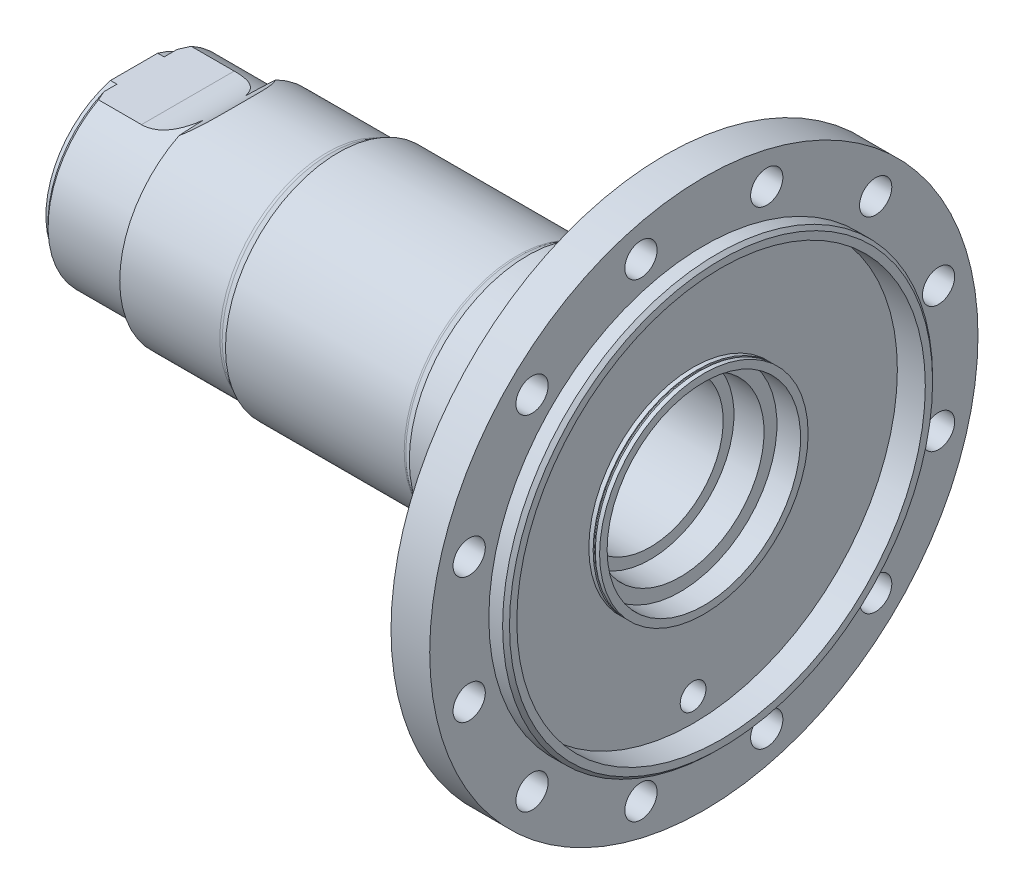
from build123d import *

# Parameters (mm, degrees)
SKETCH_3_W                    = 2
SKETCH_3_H                    = 46.5
SKETCH_5_W                    = 2
SKETCH_5_H                    = 46.5
SKETCH_6_R                    = 7.5
CUT_EXTRUDE_1_DEPTH           = 328.171973127
SKETCH_7_R                    = 7.5
CUT_EXTRUDE_2_DEPTH           = 328.171973127
SKETCH_8_R                    = 7.5
CUT_EXTRUDE_3_DEPTH           = 328.171973127
SKETCH_9_R                    = 7.5
CUT_EXTRUDE_4_DEPTH           = 328.171973127
SKETCH_10_R                   = 7.5
CUT_EXTRUDE_5_DEPTH           = 328.171973127
SKETCH_11_R                   = 7.5
CUT_EXTRUDE_6_DEPTH           = 328.171973127
SKETCH_12_R                   = 7.5
CUT_EXTRUDE_7_DEPTH           = 328.171973127
SKETCH_13_R                   = 7.5
CUT_EXTRUDE_8_DEPTH           = 328.171973127
SKETCH_14_R                   = 7.5
CUT_EXTRUDE_9_DEPTH           = 328.171973127
SKETCH_15_R                   = 7.5
CUT_EXTRUDE_10_DEPTH          = 328.171973127
SKETCH_16_R                   = 7.5
CUT_EXTRUDE_11_DEPTH          = 328.171973127
SKETCH_17_R                   = 7.5
CUT_EXTRUDE_12_DEPTH          = 328.171973127
SKETCH_18_R                   = 6
CUT_EXTRUDE_13_DEPTH          = 328.171973127
LEFT_FLAT_84_5_R35_DEPTH      = 328.171973127
LEFT_FLAT_84_5_R35_DEPTH_BACK = 328.171973127
LEFT_END_BOTTOM_20_DEPTH      = 328.171973127
LEFT_END_BOTTOM_20_DEPTH_BACK = 328.171973127
SKETCH_20_W                   = 4
SKETCH_20_H                   = 75


with BuildPart() as part:
    # Эскиз1 → Повернуть1 (revolve)
    with BuildSketch(Plane.XY, mode=Mode.PRIVATE) as revolve_1_sk:
        with BuildLine():
            Line((0, 0), (273, 0))
            Line((273, 0), (273, 98.4))
            Line((273, 98.4), (271.4, 100))
            Line((271.4, 100), (265, 100))
            Line((265, 100), (265, 127.5))
            Line((265, 127.5), (247, 127.5))
            Line((247, 127.5), (247, 94.828427125))
            ThreePointArc((247, 94.828427125), (246.847759065, 94.06306026), (246.414213562, 93.414213562))
            Line((246.414213562, 93.414213562), (245, 92))
            Line((245, 92), (245, 82.828427125))
            ThreePointArc((245, 82.828427125), (244.847759065, 82.06306026), (244.414213562, 81.414213562))
            Line((244.414213562, 81.414213562), (241, 78))
            Line((241, 78), (241, 68.328427125))
            ThreePointArc((241, 68.328427125), (240.847759065, 67.56306026), (240.414213562, 66.914213562))
            Line((240.414213562, 66.914213562), (239, 65.5))
            Line((239, 65.5), (239, 64.5))
            ThreePointArc((239, 64.5), (238.414213562, 63.085786438), (237, 62.5))
            Line((237, 62.5), (218, 62.5))
            Line((218, 62.5), (215, 60.767949192))
            Line((215, 60.767949192), (215, 57))
            ThreePointArc((215, 57), (214.414213562, 55.585786438), (213, 55))
            Line((213, 55), (183, 55))
            Line((183, 55), (179.133974596, 52.767949192))
            ThreePointArc((179.133974596, 52.767949192), (178.651612686, 52.568148347), (178.133974596, 52.5))
            Line((178.133974596, 52.5), (95, 52.5))
            Line((95, 52.5), (91.366025404, 50.401923789))
            ThreePointArc((91.366025404, 50.401923789), (90.642482539, 50.102222521), (89.866025404, 50))
            Line((89.866025404, 50), (43.339745962, 50))
            Line((43.339745962, 50), (42, 45))
            Line((42, 45), (5, 45))
            Line((5, 45), (3, 43))
            Line((3, 43), (3, 41))
            Line((3, 41), (0, 41))
            Line((0, 41), (0, 0))
        make_face()
    revolve(revolve_1_sk.sketch.rotate(Axis((0, 0, 0), (1, 0, 0)), 90), axis=Axis((0, 0, 0), (1, 0, 0)))

    # Эскиз2 → Вырез-Повернуть1 (revolve, cut)
    with BuildSketch(Plane.XY, mode=Mode.PRIVATE) as cut_revolve_1_sk:
        Polygon((0, 0), (273, 0), (273, 95), (265, 95), (265, 45), (254, 45), (254, 39), (240, 39), (240, 34), (203.5, 34), (203.5, 31), (3, 31), (0, 32.732050808), align=None)
    revolve(cut_revolve_1_sk.sketch.rotate(Axis((0, 0, 0), (1, 0, 0)), 90), axis=Axis((0, 0, 0), (1, 0, 0)), mode=Mode.SUBTRACT)

    # Эскиз3 → Rear_recess_left (revolve, cut)
    with BuildSketch(Plane.XY, mode=Mode.PRIVATE) as rear_recess_left_sk:
        with Locations((261, 71.75)):
            Rectangle(SKETCH_3_W, SKETCH_3_H)
    revolve(rear_recess_left_sk.sketch.rotate(Axis((0, 0, 0), (1, 0, 0)), 90), axis=Axis((0, 0, 0), (1, 0, 0)), mode=Mode.SUBTRACT)

    # Эскиз4 → Collar_groove_nominal (revolve, cut)
    with BuildSketch(Plane.XY, mode=Mode.PRIVATE) as collar_groove_nominal_sk:
        with BuildLine():
            Line((263, 48), (263, 95))
            Line((263, 95), (262, 95))
            Line((262, 95), (262, 48))
            ThreePointArc((262, 48), (262.146446609, 47.646446609), (262.5, 47.5))
            ThreePointArc((262.5, 47.5), (262.853553391, 47.646446609), (263, 48))
        make_face()
    revolve(collar_groove_nominal_sk.sketch.rotate(Axis((0, 0, 0), (1, 0, 0)), 90), axis=Axis((0, 0, 0), (1, 0, 0)), mode=Mode.SUBTRACT)

    # Эскиз5 → Rear_recess_lip (revolve, cut)
    with BuildSketch(Plane.XY, mode=Mode.PRIVATE) as rear_recess_lip_sk:
        with Locations((264, 71.75)):
            Rectangle(SKETCH_5_W, SKETCH_5_H)
    revolve(rear_recess_lip_sk.sketch.rotate(Axis((0, 0, 0), (1, 0, 0)), 90), axis=Axis((0, 0, 0), (1, 0, 0)), mode=Mode.SUBTRACT)

    # Эскиз6 → Вырез-Вытянуть1 (cut, through all)
    with BuildSketch(Plane(origin=(0, 0, 0), x_dir=(0, 0, -1), z_dir=(1, 0, 0))):
        with Locations(Location((109.149618371, 29.246552097, 0), (0, 0, 180))):
            Circle(SKETCH_6_R)
    extrude(amount=CUT_EXTRUDE_1_DEPTH, mode=Mode.SUBTRACT)

    # Эскиз7 → Вырез-Вытянуть2 (cut, through all)
    with BuildSketch(Plane(origin=(0, 0, 0), x_dir=(0, 0, -1), z_dir=(1, 0, 0))):
        with Locations(Location((79.903066274, 79.903066274, 0), (0, 0, 180))):
            Circle(SKETCH_7_R)
    extrude(amount=CUT_EXTRUDE_2_DEPTH, mode=Mode.SUBTRACT)

    # Эскиз8 → Вырез-Вытянуть3 (cut, through all)
    with BuildSketch(Plane(origin=(0, 0, 0), x_dir=(0, 0, -1), z_dir=(1, 0, 0))):
        with Locations(Location((29.246552097, 109.149618371, 0), (0, 0, 180))):
            Circle(SKETCH_8_R)
    extrude(amount=CUT_EXTRUDE_3_DEPTH, mode=Mode.SUBTRACT)

    # Эскиз9 → Вырез-Вытянуть4 (cut, through all)
    with BuildSketch(Plane(origin=(0, 0, 0), x_dir=(0, 0, -1), z_dir=(1, 0, 0))):
        with Locations(Location((-29.246552097, 109.149618371, 0), (0, 0, 180))):
            Circle(SKETCH_9_R)
    extrude(amount=CUT_EXTRUDE_4_DEPTH, mode=Mode.SUBTRACT)

    # Эскиз10 → Вырез-Вытянуть5 (cut, through all)
    with BuildSketch(Plane(origin=(0, 0, 0), x_dir=(0, 0, -1), z_dir=(1, 0, 0))):
        with Locations(Location((-79.903066274, 79.903066274, 0), (0, 0, 180))):
            Circle(SKETCH_10_R)
    extrude(amount=CUT_EXTRUDE_5_DEPTH, mode=Mode.SUBTRACT)

    # Эскиз11 → Вырез-Вытянуть6 (cut, through all)
    with BuildSketch(Plane(origin=(0, 0, 0), x_dir=(0, 0, -1), z_dir=(1, 0, 0))):
        with Locations(Location((-109.149618371, 29.246552097, 0), (0, 0, 180))):
            Circle(SKETCH_11_R)
    extrude(amount=CUT_EXTRUDE_6_DEPTH, mode=Mode.SUBTRACT)

    # Эскиз12 → Вырез-Вытянуть7 (cut, through all)
    with BuildSketch(Plane(origin=(0, 0, 0), x_dir=(0, 0, -1), z_dir=(1, 0, 0))):
        with Locations(Location((-109.149618371, -29.246552097, 0), (0, 0, 180))):
            Circle(SKETCH_12_R)
    extrude(amount=CUT_EXTRUDE_7_DEPTH, mode=Mode.SUBTRACT)

    # Эскиз13 → Вырез-Вытянуть8 (cut, through all)
    with BuildSketch(Plane(origin=(0, 0, 0), x_dir=(0, 0, -1), z_dir=(1, 0, 0))):
        with Locations(Location((-79.903066274, -79.903066274, 0), (0, 0, 180))):
            Circle(SKETCH_13_R)
    extrude(amount=CUT_EXTRUDE_8_DEPTH, mode=Mode.SUBTRACT)

    # Эскиз14 → Вырез-Вытянуть9 (cut, through all)
    with BuildSketch(Plane(origin=(0, 0, 0), x_dir=(0, 0, -1), z_dir=(1, 0, 0))):
        with Locations(Location((-29.246552097, -109.149618371, 0), (0, 0, 180))):
            Circle(SKETCH_14_R)
    extrude(amount=CUT_EXTRUDE_9_DEPTH, mode=Mode.SUBTRACT)

    # Эскиз15 → Вырез-Вытянуть10 (cut, through all)
    with BuildSketch(Plane(origin=(0, 0, 0), x_dir=(0, 0, -1), z_dir=(1, 0, 0))):
        with Locations(Location((29.246552097, -109.149618371, 0), (0, 0, 180))):
            Circle(SKETCH_15_R)
    extrude(amount=CUT_EXTRUDE_10_DEPTH, mode=Mode.SUBTRACT)

    # Эскиз16 → Вырез-Вытянуть11 (cut, through all)
    with BuildSketch(Plane(origin=(0, 0, 0), x_dir=(0, 0, -1), z_dir=(1, 0, 0))):
        with Locations(Location((79.903066274, -79.903066274, 0), (0, 0, 180))):
            Circle(SKETCH_16_R)
    extrude(amount=CUT_EXTRUDE_11_DEPTH, mode=Mode.SUBTRACT)

    # Эскиз17 → Вырез-Вытянуть12 (cut, through all)
    with BuildSketch(Plane(origin=(0, 0, 0), x_dir=(0, 0, -1), z_dir=(1, 0, 0))):
        with Locations(Location((109.149618371, -29.246552097, 0), (0, 0, 180))):
            Circle(SKETCH_17_R)
    extrude(amount=CUT_EXTRUDE_12_DEPTH, mode=Mode.SUBTRACT)

    # Эскиз18 → Вырез-Вытянуть13 (cut, through all)
    with BuildSketch(Plane(origin=(0, 0, 0), x_dir=(0, 0, -1), z_dir=(1, 0, 0))):
        with Locations(Location((0, -84, 0), (0, 0, 166.725608927))):
            Circle(SKETCH_18_R)
    extrude(amount=CUT_EXTRUDE_13_DEPTH, mode=Mode.SUBTRACT)

    # Эскиз19 → Left_flat_84_5_R35 (cut, two sides: drawn at the far end of the back side and taken through both)
    with BuildSketch(Plane.XY.offset(-LEFT_FLAT_84_5_R35_DEPTH_BACK)):
        with BuildLine():
            Line((-1, 39.5), (25, 39.5))
            ThreePointArc((25, 39.5), (49.748737342, 49.751262658), (60, 74.5))
            Line((60, 74.5), (60, 150))
            Line((60, 150), (-1, 150))
            Line((-1, 150), (-1, 39.5))
        make_face()
    extrude(amount=LEFT_FLAT_84_5_R35_DEPTH + LEFT_FLAT_84_5_R35_DEPTH_BACK, mode=Mode.SUBTRACT)

    # Эскиз20 → Left_end_bottom_20 (cut, two sides: drawn at the far end of the back side and taken through both)
    with BuildSketch(Plane.XY.offset(-LEFT_END_BOTTOM_20_DEPTH_BACK)):
        with Locations((1, -62.5)):
            Rectangle(SKETCH_20_W, SKETCH_20_H)
    extrude(amount=LEFT_END_BOTTOM_20_DEPTH + LEFT_END_BOTTOM_20_DEPTH_BACK, mode=Mode.SUBTRACT)


solid = part.part
